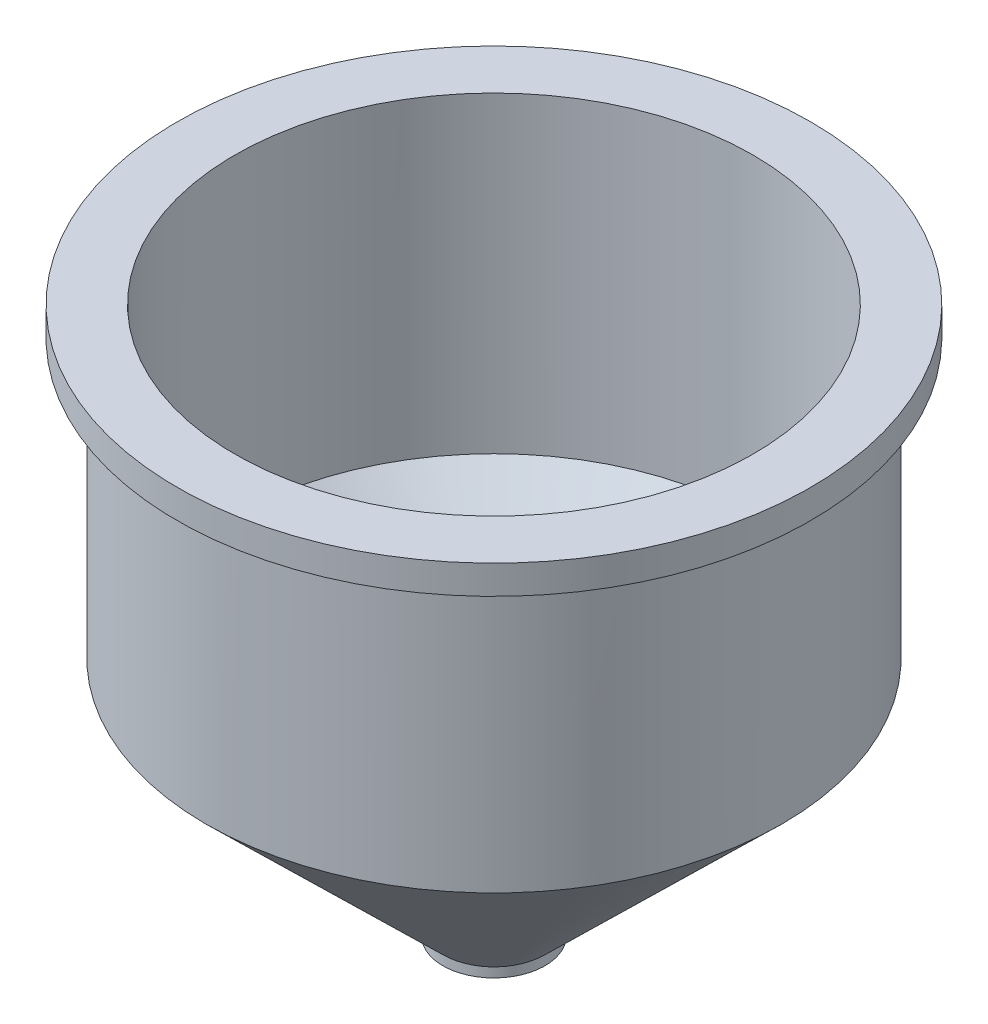
from build123d import *


with BuildPart() as part:
    # 草图1 → 旋转2 (revolve)
    with BuildSketch(Plane.XY, mode=Mode.PRIVATE) as revolve_2_sk:
        Polygon((0, -57), (5.329106181, -57), (5.329106181, -56), (30, -31.885456331), (30, -3), (33, -3), (33, 0), (27, 0), (27, -32.547808545), (7.8, -51), (3.8, -51), (3.8, -56), (0, -56), align=None)
    revolve(revolve_2_sk.sketch.rotate(Axis((0, -69.973397686, 0), (0, 1, 0)), 90), axis=Axis((0, -69.973397686, 0), (0, 1, 0)))


solid = part.part
